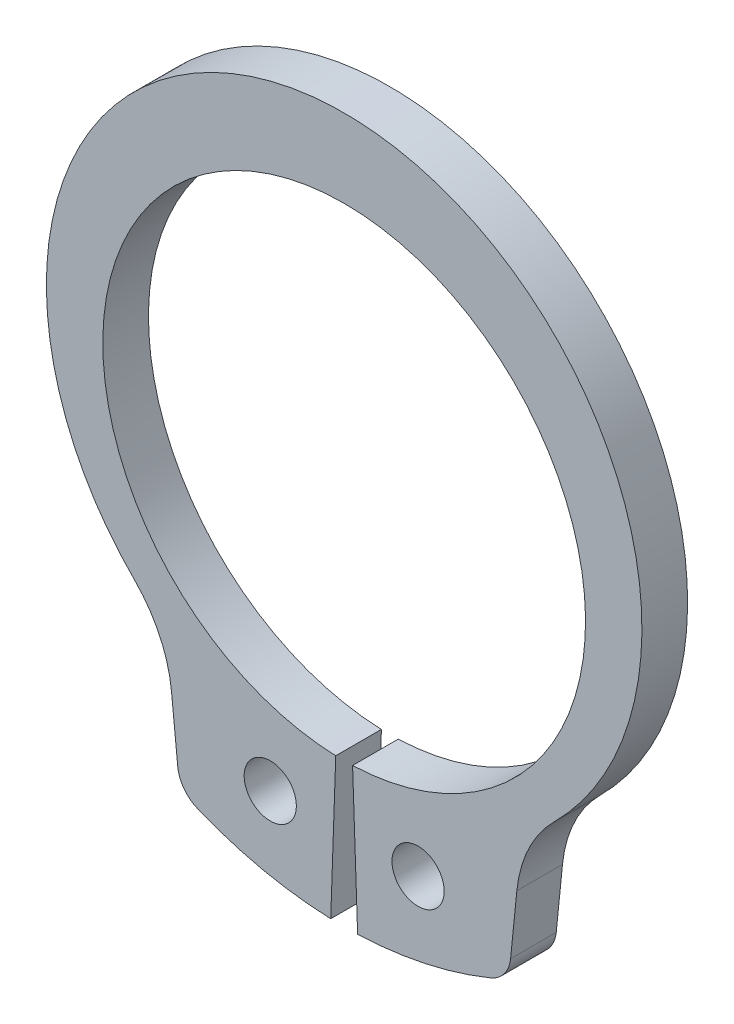
from build123d import *

# Parameters (mm, degrees)
SKETCH2_R           = 1
BOSS_EXTRUDE1_DEPTH = 0.875
FILLET1_R           = 4.931461029
FILLET2_R           = 1.232865257


with BuildPart() as part:
    # Sketch2 → Boss-Extrude1 (new, symmetric)
    with BuildSketch(Plane.XY):
        with BuildLine():
            Line((-6.305638026, -13.344164937), (-6.812354384, -8.315908113))
            ThreePointArc((-6.812354384, -8.315908113), (-10.832413729, 4.42694972), (0, 12.25))
            Line((0, 12.25), (0, 9.25))
            ThreePointArc((0, 9.25), (-9.24859118, 0.16143476), (-0.322820344, -9.24436515))
            Line((-0.322820344, -9.24436515), (-0.51508135, -14.75))
            ThreePointArc((-0.51508135, -14.75), (-3.482046275, -14.342355544), (-6.305638026, -13.344164937))
        make_face()
        with Locations((-2.832186094, -11.665617492)):
            Circle(SKETCH2_R, mode=Mode.SUBTRACT)
    extrude(amount=BOSS_EXTRUDE1_DEPTH, both=True)

    # Fillet1
    fillet1_edges = [part.edges().sort_by_distance(p)[0] for p in [
        (-6.812354384, -8.315908113, 0),
    ]]
    fillet(fillet1_edges, radius=FILLET1_R)

    # Fillet2
    fillet2_edges = [part.edges().sort_by_distance(p)[0] for p in [
        (-6.305638026, -13.344164937, 0),
    ]]
    fillet(fillet2_edges, radius=FILLET2_R)

    # Mirror1: part across plane


with BuildPart() as part_1:
    add(part.part)
    add(part.part.mirror(Plane(origin=(0, 12.25, 0.875), x_dir=(0, 0, 1), z_dir=(-1, 0, 0))))


solid = part_1.part
